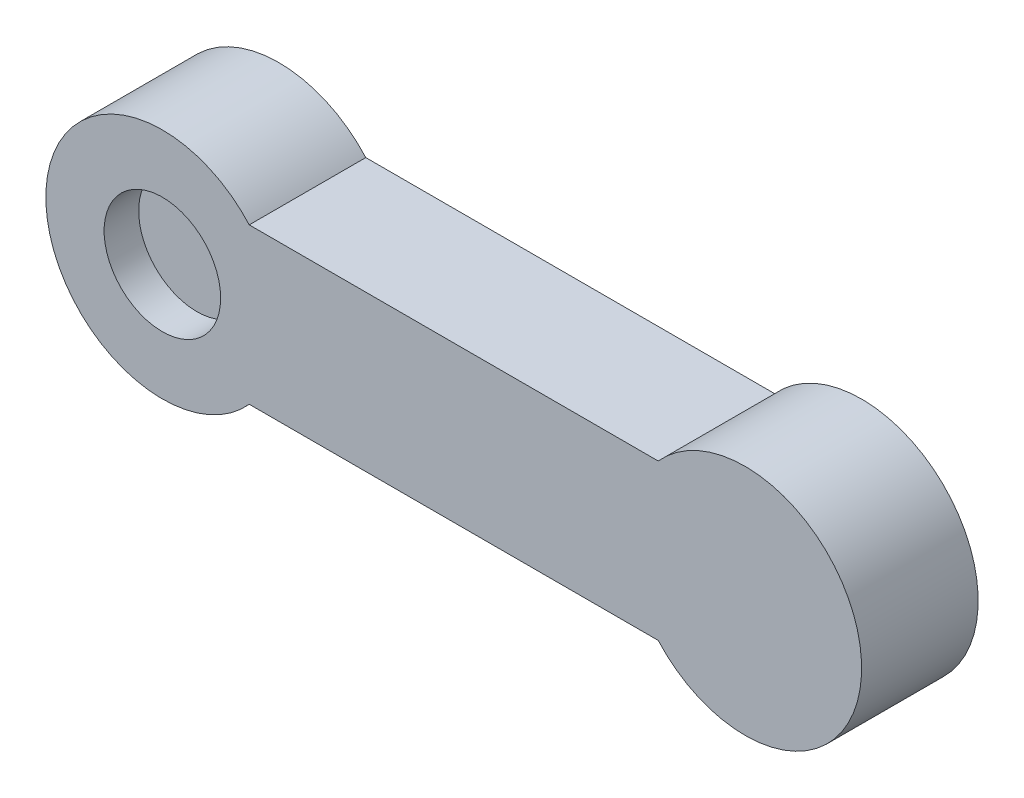
from build123d import *

# Parameters (mm, degrees)
SKETCH1_R           = 30
SKETCH1_W           = 150
SKETCH1_H           = 40
BOSS_EXTRUDE1_DEPTH = 30
SKETCH2_R           = 15
CUT_EXTRUDE1_DEPTH  = 8.9


with BuildPart() as part:
    # Sketch1 → Boss-Extrude1 (new body)
    with BuildSketch(Plane.XY):
        Circle(SKETCH1_R)
        with Locations((150, 0)):
            Circle(SKETCH1_R)
        with Locations((75, 0)):
            Rectangle(SKETCH1_W, SKETCH1_H)
    extrude(amount=BOSS_EXTRUDE1_DEPTH)

    # Sketch2 → Cut-Extrude1 (cut)
    with BuildSketch(Plane.XY.offset(30)):
        Circle(SKETCH2_R)
    extrude(amount=-CUT_EXTRUDE1_DEPTH, mode=Mode.SUBTRACT)


solid = part.part
